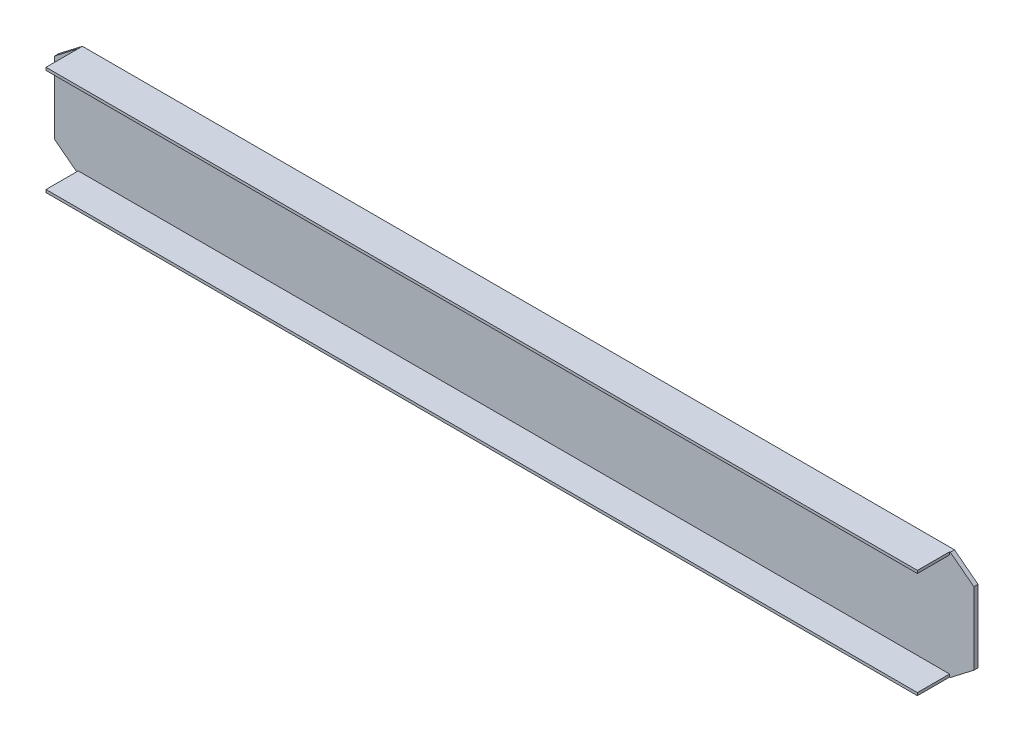
from build123d import *

# Parameters (mm, degrees)
EXTRUDE_663_DEPTH = 11.5
SKETCH_2_W        = 2408.049034164
SKETCH_2_H        = 7.5
EXTRUDE_1_DEPTH   = 89
SKETCH_3_W        = 80
SKETCH_3_H        = 240
EXTRUDE_2_DEPTH   = 16


with BuildPart() as part:
    # 草图1 → Extrude 663 (new body)
    with BuildSketch(Plane.XY):
        Polygon((-1205, 0), (1205, 0), (1270, 50), (1270, 250), (1205, 300), (-1205, 300), (-1270, 250), (-1270, 50), align=None)
    extrude(amount=-EXTRUDE_663_DEPTH)

    # 草图2 → 凸台-拉伸1 (add)
    with BuildSketch(Plane.XY):
        with Locations((-0.975482918, 296.25)):
            Rectangle(SKETCH_2_W, SKETCH_2_H)
        with Locations((-0.975482918, 3.75)):
            Rectangle(SKETCH_2_W, SKETCH_2_H)
    extrude(amount=EXTRUDE_1_DEPTH)

    # 草图3 → 凸台-拉伸2 (add)
    with BuildSketch(Plane(origin=(0, 0, -11.5), x_dir=(-1, 0, 0), z_dir=(0, 0, -1))):
        with Locations((-580, 150)):
            Rectangle(SKETCH_3_W, SKETCH_3_H)
        with Locations((-180, 150)):
            Rectangle(SKETCH_3_W, SKETCH_3_H)
        with Locations((180, 150)):
            Rectangle(SKETCH_3_W, SKETCH_3_H)
        with Locations((580, 150)):
            Rectangle(SKETCH_3_W, SKETCH_3_H)
    extrude(amount=EXTRUDE_2_DEPTH)


solid = part.part
